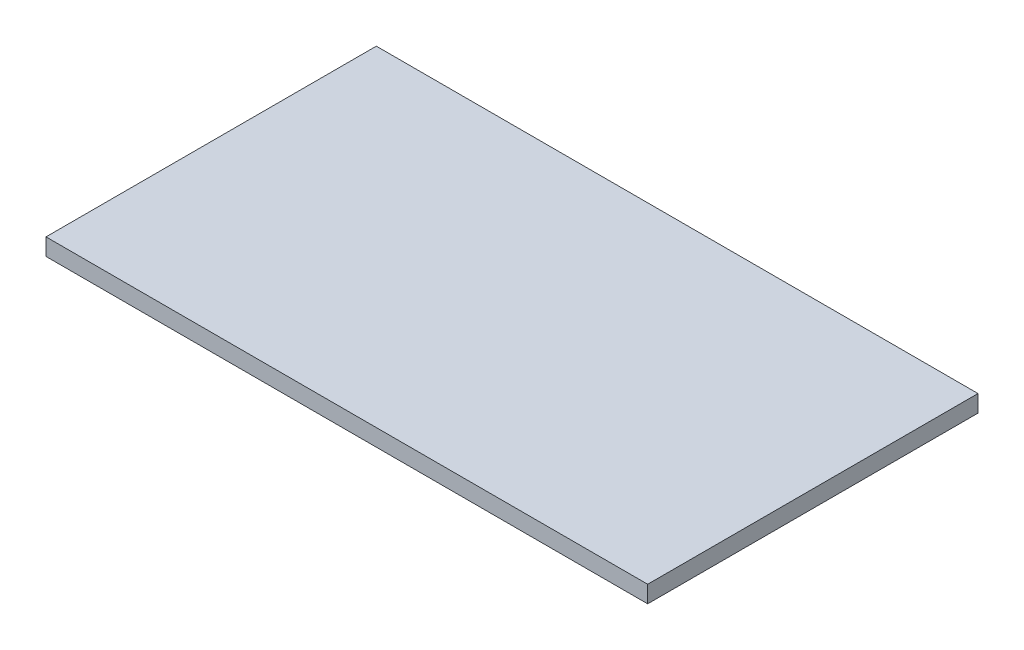
from build123d import *

# Parameters (mm, degrees)
SKETCH1_W           = 161.925
SKETCH1_H           = 88.9
BOSS_EXTRUDE1_DEPTH = 4.572


with BuildPart() as part:
    # Sketch1 → Boss-Extrude1 (new body)
    with BuildSketch(Plane(origin=(0, 0, 0), x_dir=(1, 0, 0), z_dir=(0, 1, 0))):
        Rectangle(SKETCH1_W, SKETCH1_H)
    extrude(amount=BOSS_EXTRUDE1_DEPTH)


solid = part.part
